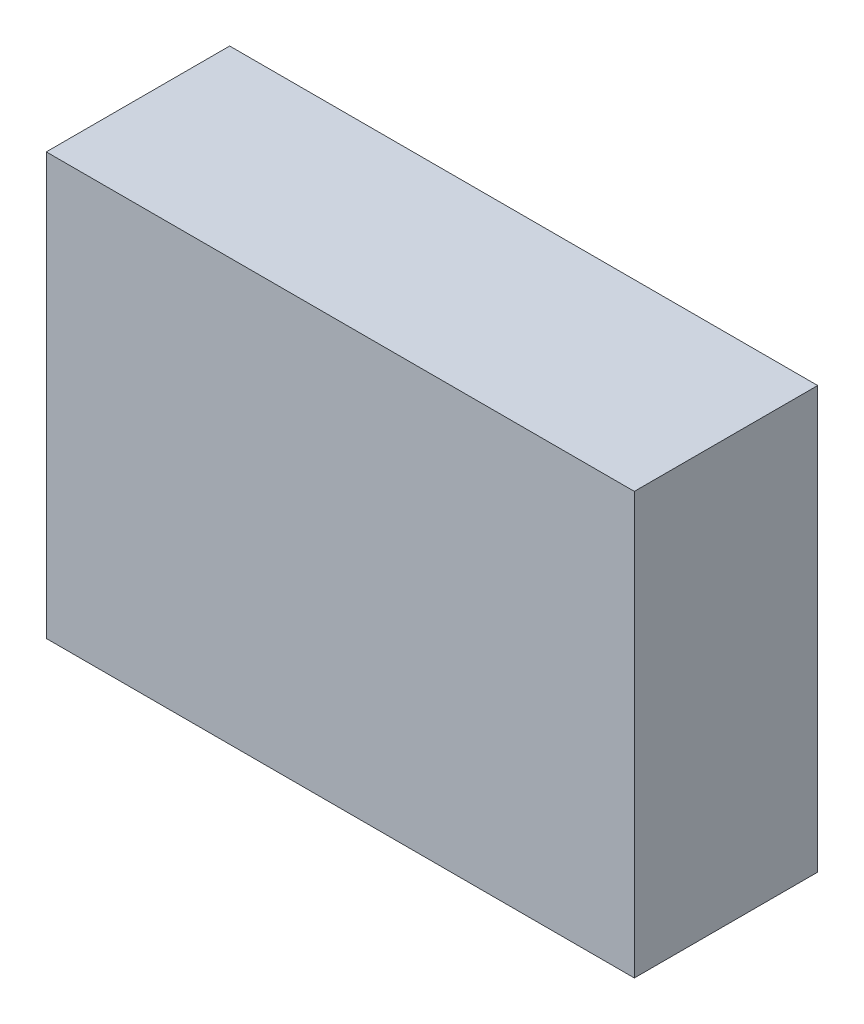
from build123d import *

# Parameters (mm, degrees)
SKETCH_1_W      = 16.034193654
SKETCH_1_H      = 11.49117212
EXTRUDE_1_DEPTH = 5


with BuildPart() as part:
    # 草图1 → 凸台-拉伸1 (new body)
    with BuildSketch(Plane.XY):
        Rectangle(SKETCH_1_W, SKETCH_1_H)
    extrude(amount=EXTRUDE_1_DEPTH)


solid = part.part
